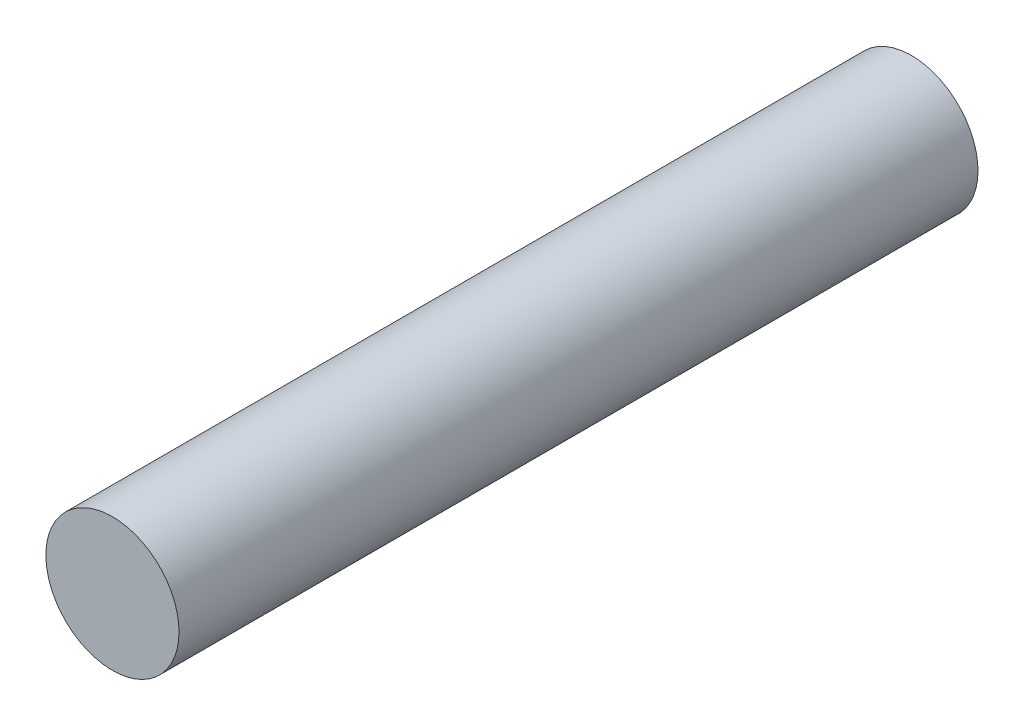
from build123d import *

# Parameters (mm, degrees)
SKETCH1_R           = 1
BOSS_EXTRUDE1_DEPTH = 13
CUT_EXTRUDE1_START  = -1
SKETCH2_R           = 1
CUT_EXTRUDE1_DEPTH  = 1


with BuildPart() as part:
    # Sketch1 → Boss-Extrude1 (new body)
    with BuildSketch(Plane.XY):
        Circle(SKETCH1_R)
    extrude(amount=BOSS_EXTRUDE1_DEPTH)

    # Sketch2 → Cut-Extrude1 (cut)
    with BuildSketch(Plane.XY.offset(13).offset(CUT_EXTRUDE1_START)):
        Circle(SKETCH2_R)
    extrude(amount=CUT_EXTRUDE1_DEPTH, mode=Mode.SUBTRACT)


solid = part.part
